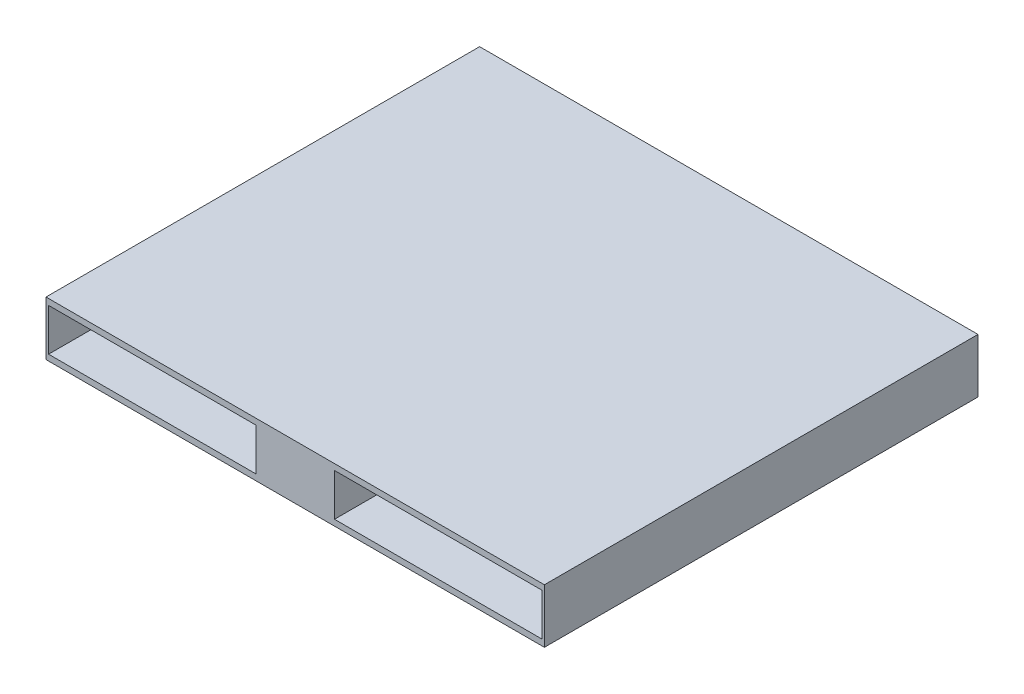
from build123d import *

# Parameters (mm, degrees)
CROQUIS1_W              = 1200
CROQUIS1_H              = 800
SALIENTE_EXTRUIR1_DEPTH = 100
CROQUIS2_W              = 382.5
CROQUIS2_H              = 78
CORTAR_EXTRUIR2_DEPTH   = 1446.68322948
CROQUIS3_W              = 140.2375
CROQUIS3_H              = 100
CORTAR_EXTRUIR3_DEPTH   = 1446.68322948


with BuildPart() as part:
    # Croquis1 → Saliente-Extruir1 (new body)
    with BuildSketch(Plane(origin=(0, 0, 0), x_dir=(1, 0, 0), z_dir=(0, 1, 0))):
        with Locations((600, 400)):
            Rectangle(CROQUIS1_W, CROQUIS1_H)
    extrude(amount=SALIENTE_EXTRUIR1_DEPTH)

    # Croquis2 → Cortar-Extruir2 (cut, through all)
    with BuildSketch(Plane.XY):
        with Locations((336.25, 50)):
            Rectangle(CROQUIS2_W, CROQUIS2_H)
        with Locations((863.75, 50)):
            Rectangle(CROQUIS2_W, CROQUIS2_H)
    extrude(amount=-CORTAR_EXTRUIR2_DEPTH, mode=Mode.SUBTRACT)

    # Croquis3 → Cortar-Extruir3 (cut, through all)
    with BuildSketch(Plane.XY):
        with Locations((70.11875, 50)):
            Rectangle(CROQUIS3_W, CROQUIS3_H)
        with Locations((1129.88125, 50)):
            Rectangle(CROQUIS3_W, CROQUIS3_H)
    extrude(amount=-CORTAR_EXTRUIR3_DEPTH, mode=Mode.SUBTRACT)


solid = part.part
